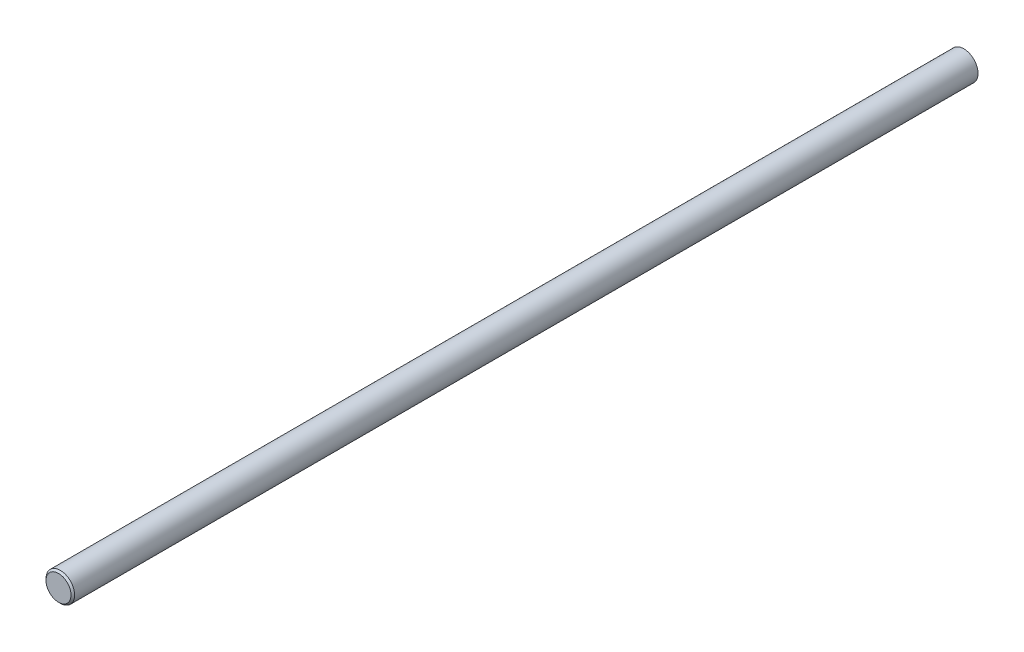
from build123d import *

# Parameters (mm, degrees)
SKETCH3_R           = 3
BOSS_EXTRUDE1_DEPTH = 152.4
CHAMFER1_SIZE       = 0.375
SKETCH4_R           = 3
CUT_EXTRUDE1_DEPTH  = 191.047362518


with BuildPart() as part:
    # Sketch3 → Boss-Extrude1 (new, symmetric)
    with BuildSketch(Plane.XY):
        with Locations(Location((0, 0, 0), (0, 0, 180))):
            Circle(SKETCH3_R)
    extrude(amount=BOSS_EXTRUDE1_DEPTH, both=True)

    # Chamfer1
    chamfer1_edges = [part.edges().sort_by_distance(p)[0] for p in [
        (3, 0, -152.4),
        (3, 0, 152.4),
    ]]
    chamfer(chamfer1_edges, length=CHAMFER1_SIZE)

    # Sketch4 → Cut-Extrude1 (cut, through all)
    with BuildSketch(Plane.XY.offset(-37.6)):
        with Locations(Location((0, 0, 0), (0, 0, 180))):
            Circle(SKETCH4_R)
    extrude(amount=-CUT_EXTRUDE1_DEPTH, mode=Mode.SUBTRACT)


solid = part.part
